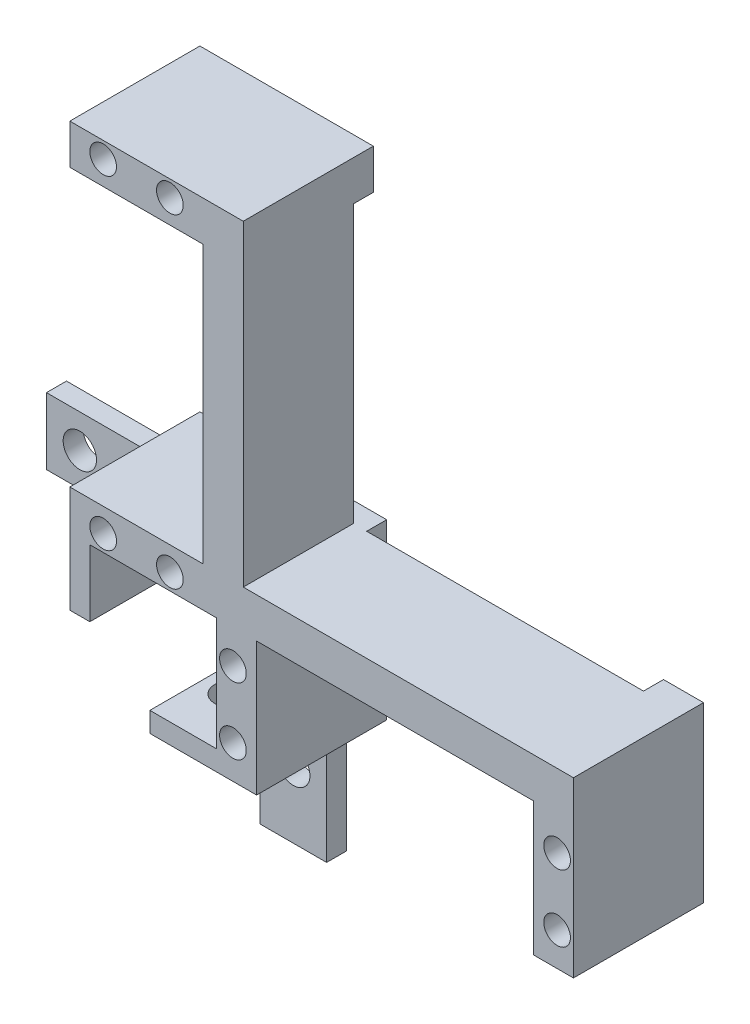
from build123d import *

# Parameters (mm, degrees)
EXTRUDE_1_DEPTH      = 16.5
SKETCH_2_R           = 2.5
CUT_EXTRUDE_1_DEPTH  = 16.5
SKETCH_3_W           = 10
SKETCH_3_H           = 16.5
CUT_EXTRUDE_2_DEPTH  = 3
SKETCH_4_W           = 11.896315449
SKETCH_4_H           = 29.084641161
CUT_EXTRUDE_3_DEPTH  = 48.945933091
SKETCH_5_R           = 2
CUT_EXTRUDE_4_DEPTH  = 48.945933091
SKETCH_6_W           = 10
SKETCH_6_H           = 23
EXTRUDE_2_DEPTH      = 3
SKETCH_7_R           = 2.5
CUT_EXTRUDE_5_DEPTH  = 3
EXTRUDE_START        = 3
SKETCH_8_R           = 2
SKETCH_8_W           = 6
SKETCH_8_H           = 26
EXTRUDE_3_DEPTH      = 3
SKETCH_9_R           = 2.5
CUT_EXTRUDE_6_DEPTH  = 3
SKETCH_10_W          = 74.694005649
SKETCH_10_H          = 52.095093629
CUT_EXTRUDE_7_DEPTH  = 116.604119736
SKETCH_11_W          = 16.482634167
SKETCH_11_H          = 25.810545036
CUT_EXTRUDE_8_DEPTH  = 10
SKETCH_13_R          = 2
EXTRUDE_4_DEPTH      = 19.5
SKETCH_14_W          = 6
SKETCH_14_H          = 41.5
CUT_EXTRUDE_9_DEPTH  = 3
SKETCH_15_W          = 23
SKETCH_15_H          = 10
SKETCH_15_R          = 2.5
EXTRUDE_5_DEPTH      = 3
SKETCH_16_W          = 3
SKETCH_16_H          = 10
EXTRUDE_6_DEPTH      = 16.5
SKETCH_17_R          = 2.5
CUT_EXTRUDE_10_DEPTH = 3


with BuildPart() as part:
    # 草图1 → 凸台-拉伸1 (new body)
    with BuildSketch(Plane.XY):
        Polygon((0, 0), (26.75, 0), (26.75, -20), (36.75, -20), (36.75, -26), (20.75, -26), (20.75, -6), (0, -6), (-20.75, -6), (-20.75, -26), (-36.75, -26), (-36.75, -20), (-26.75, -20), (-26.75, 0), align=None)
    extrude(amount=EXTRUDE_1_DEPTH)

    # 草图2 → 切除-拉伸1 (cut)
    with BuildSketch(Plane(origin=(0, -20, 0), x_dir=(1, 0, 0), z_dir=(0, 1, 0))):
        with Locations(Location((32.75, -8.25, 0), (0, 0, 270))):
            Circle(SKETCH_2_R)
    extrude(amount=-CUT_EXTRUDE_1_DEPTH, mode=Mode.SUBTRACT)

    # 草图3 → 切除-拉伸2 (cut)
    with BuildSketch(Plane(origin=(0, -20, 0), x_dir=(1, 0, 0), z_dir=(0, 1, 0))):
        with Locations((31.75, -8.25)):
            Rectangle(SKETCH_3_W, SKETCH_3_H)
    extrude(amount=-CUT_EXTRUDE_2_DEPTH, mode=Mode.SUBTRACT)

    # 草图4 → 切除-拉伸3 (cut, through all)
    with BuildSketch(Plane.XY.offset(16.5)):
        with Locations((-32.698157724, -14.542320581)):
            Rectangle(SKETCH_4_W, SKETCH_4_H)
    extrude(amount=-CUT_EXTRUDE_3_DEPTH, mode=Mode.SUBTRACT)

    # 草图5 → 切除-拉伸4 (cut, through all)
    with BuildSketch(Plane(origin=(0, 0, 0), x_dir=(-1, 0, 0), z_dir=(0, 0, -1))):
        with Locations((-24.3, -11)):
            Circle(SKETCH_5_R)
        with Locations((-24.3, -21)):
            Circle(SKETCH_5_R)
        with Locations(Location((24.3, -21, 0), (0, 0, 180))):
            Circle(SKETCH_5_R)
        with Locations(Location((24.3, -11, 0), (0, 0, 180))):
            Circle(SKETCH_5_R)
    extrude(amount=-CUT_EXTRUDE_4_DEPTH, mode=Mode.SUBTRACT)

    # 草图6 → 凸台-拉伸2 (add)
    with BuildSketch(Plane(origin=(0, 0, 0), x_dir=(-1, 0, 0), z_dir=(0, 0, -1))):
        with Locations((-31.75, -34.5)):
            Rectangle(SKETCH_6_W, SKETCH_6_H)
    extrude(amount=EXTRUDE_2_DEPTH)

    # 草图7 → 切除-拉伸5 (cut)
    with BuildSketch(Plane(origin=(0, 0, -3), x_dir=(-1, 0, 0), z_dir=(0, 0, -1))):
        with Locations((-31.75, -36)):
            Circle(SKETCH_7_R)
    extrude(amount=-CUT_EXTRUDE_5_DEPTH, mode=Mode.SUBTRACT)

    # 草图8 → 凸台-拉伸3 (add)
    # profile 1 of 2: a face of its own
    with BuildSketch(Plane(origin=(0, 0, 0), x_dir=(-1, 0, 0), z_dir=(0, 0, -1)).offset(EXTRUDE_START)):
        Polygon((26.75, 0), (20.75, 0), (20.75, -46), (26.75, -46), (30.75, -46), (30.75, -26), (26.75, -26), align=None)
        with Locations((24.3, -21)):
            Circle(SKETCH_8_R, mode=Mode.SUBTRACT)
        with Locations((24.3, -11)):
            Circle(SKETCH_8_R, mode=Mode.SUBTRACT)
    # profile 2 of 2: a face of its own
    with BuildSketch(Plane(origin=(0, 0, 0), x_dir=(-1, 0, 0), z_dir=(0, 0, -1)).offset(EXTRUDE_START)):
        with Locations((-23.75, -13)):
            Rectangle(SKETCH_8_W, SKETCH_8_H)
        with Locations((-24.3, -11)):
            Circle(SKETCH_8_R, mode=Mode.SUBTRACT)
        with Locations((-24.3, -21)):
            Circle(SKETCH_8_R, mode=Mode.SUBTRACT)
    extrude(amount=-EXTRUDE_3_DEPTH)

    # 草图9 → 切除-拉伸6 (cut)
    with BuildSketch(Plane(origin=(0, 0, -3), x_dir=(-1, 0, 0), z_dir=(0, 0, -1))):
        with Locations((25.75, -36)):
            Circle(SKETCH_9_R)
    extrude(amount=-CUT_EXTRUDE_6_DEPTH, mode=Mode.SUBTRACT)

    # 镜向1: part across plane


with BuildPart() as part_1:
    add(part.part)
    add(part.part.mirror(Plane(origin=(36.75, -20, 16.5), x_dir=(0, 0, 1), z_dir=(-1, 0, 0))))

    # 草图10 → 切除-拉伸7 (cut, through all)
    with BuildSketch(Plane(origin=(0, 0, -3), x_dir=(-1, 0, 0), z_dir=(0, 0, -1))):
        with Locations((0.597002825, -19.952453186)):
            Rectangle(SKETCH_10_W, SKETCH_10_H)
    extrude(amount=-CUT_EXTRUDE_7_DEPTH, mode=Mode.SUBTRACT)

    # 草图11 → 切除-拉伸8 (cut)
    with BuildSketch(Plane(origin=(0, 0, -3), x_dir=(-1, 0, 0), z_dir=(0, 0, -1))):
        with Locations((-102.491317084, -38.905272518)):
            Rectangle(SKETCH_11_W, SKETCH_11_H)
    extrude(amount=-CUT_EXTRUDE_8_DEPTH, mode=Mode.SUBTRACT)

    # 草图13 → 凸台-拉伸4 (add)
    with BuildSketch(Plane(origin=(0, 0, -3), x_dir=(-1, 0, 0), z_dir=(0, 0, -1))):
        Polygon((-24.75, -6), (-50.75, -6), (-50.75, 47.5), (-24.75, 47.5), (-24.75, 41.5), (-44.75, 41.5), (-44.75, 0), (-24.75, 0), align=None)
        with Locations((-29.75, -3.55)):
            Circle(SKETCH_13_R, mode=Mode.SUBTRACT)
        with Locations((-39.75, -3.55)):
            Circle(SKETCH_13_R, mode=Mode.SUBTRACT)
        with Locations(Location((-39.75, 45.05, 0), (0, 0, 180))):
            Circle(SKETCH_13_R, mode=Mode.SUBTRACT)
        with Locations(Location((-29.75, 45.05, 0), (0, 0, 180))):
            Circle(SKETCH_13_R, mode=Mode.SUBTRACT)
    extrude(amount=-EXTRUDE_4_DEPTH)

    # 草图14 → 切除-拉伸9 (cut)
    with BuildSketch(Plane(origin=(0, 0, -3), x_dir=(-1, 0, 0), z_dir=(0, 0, -1))):
        with Locations((-47.75, 20.75)):
            Rectangle(SKETCH_14_W, SKETCH_14_H)
    extrude(amount=-CUT_EXTRUDE_9_DEPTH, mode=Mode.SUBTRACT)

    # 草图15 → 凸台-拉伸5 (add)
    with BuildSketch(Plane(origin=(0, 0, -3), x_dir=(-1, 0, 0), z_dir=(0, 0, -1))):
        with Locations((-16.25, -11)):
            Rectangle(SKETCH_15_W, SKETCH_15_H)
        with Locations((-9.75, -11)):
            Circle(SKETCH_15_R, mode=Mode.SUBTRACT)
    extrude(amount=-EXTRUDE_5_DEPTH)

    # 草图16 → 凸台-拉伸6 (add)
    with BuildSketch(Plane.XY):
        with Locations((26.25, -11)):
            Rectangle(SKETCH_16_W, SKETCH_16_H)
    extrude(amount=EXTRUDE_6_DEPTH)

    # 草图17 → 切除-拉伸10 (cut)
    with BuildSketch(Plane.ZY.offset(-24.75)):
        with Locations(Location((6.5, -11, 0), (0, 0, 270))):
            Circle(SKETCH_17_R)
    extrude(amount=-CUT_EXTRUDE_10_DEPTH, mode=Mode.SUBTRACT)


solid = part_1.part
